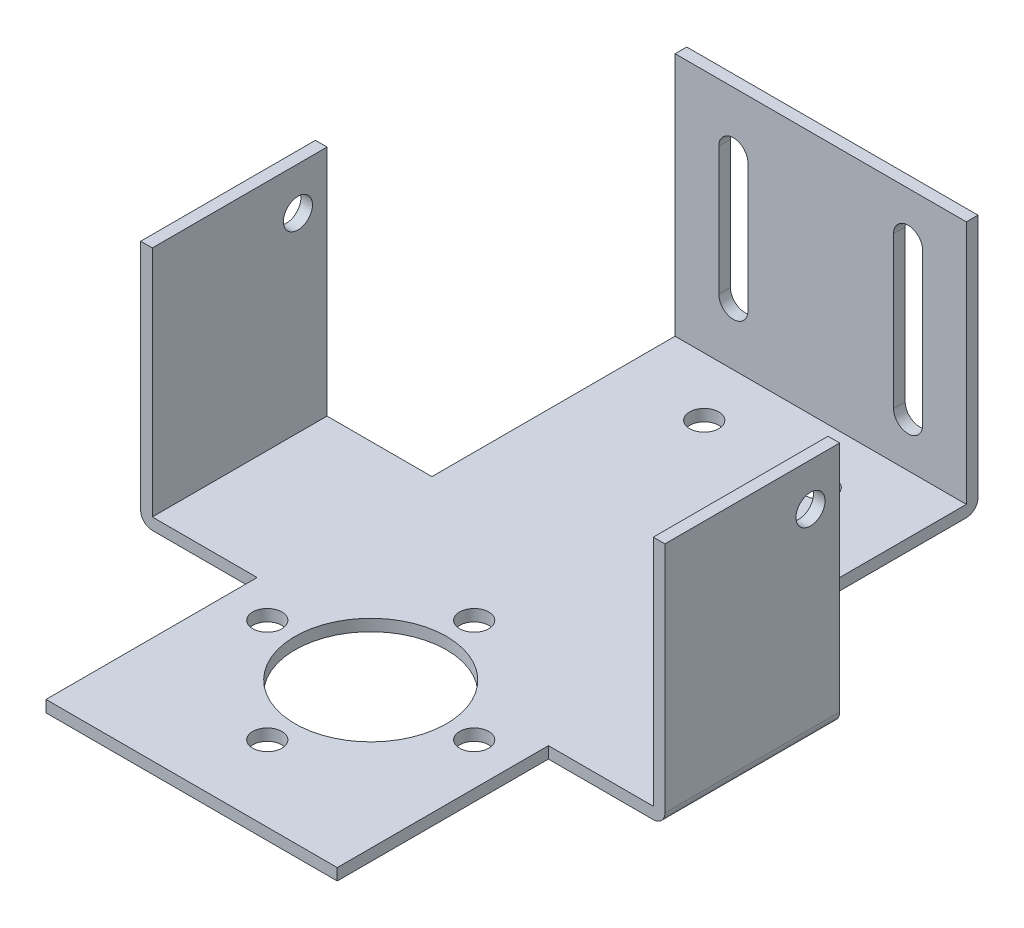
from build123d import *

# Parameters (mm, degrees)
SKETCH_1_W          = 50
SKETCH_1_H          = 42
EXTRUDE_1_DEPTH     = 2
SKETCH_2_W          = 50
SKETCH_2_H          = 110
EXTRUDE_2_DEPTH     = 2
CUT_EXTRUDE_1_REACH = 123.083
SKETCH_3_R          = 2.5
CUT_EXTRUDE_2_REACH = 123.083
SKETCH_4_R          = 13
FILLET_1_R          = 2
SKETCH_5_W          = 30
SKETCH_5_H          = 2
EXTRUDE_3_DEPTH     = 18
SKETCH_6_W          = 30
SKETCH_6_H          = 42
EXTRUDE_4_DEPTH     = 2
FILLET_2_R          = 2
CUT_EXTRUDE_3_REACH = 144.734
SKETCH_7_R          = 2.5
CUT_EXTRUDE_4_REACH = 128.732
SKETCH_8_R          = 2.5


with BuildPart() as part:
    # 草图1 → 凸台-拉伸1 (new body)
    with BuildSketch(Plane.XY):
        Rectangle(SKETCH_1_W, SKETCH_1_H)
        with BuildLine():
            Line((-17.5, 11), (-17.5, -11))
            ThreePointArc((-17.5, -11), (-15, -13.5), (-12.5, -11))
            Line((-12.5, -11), (-12.5, 11))
            ThreePointArc((-12.5, 11), (-15, 13.5), (-17.5, 11))
        make_face(mode=Mode.SUBTRACT)
        with BuildLine():
            Line((12.5, 13), (12.5, -13))
            ThreePointArc((12.5, -13), (15, -15.5), (17.5, -13))
            Line((17.5, -13), (17.5, 13))
            ThreePointArc((17.5, 13), (15, 15.5), (12.5, 13))
        make_face(mode=Mode.SUBTRACT)
    extrude(amount=EXTRUDE_1_DEPTH)

    # 草图2 → 凸台-拉伸2 (add)
    with BuildSketch(Plane.XZ.offset(21)):
        with Locations((0, 55)):
            Rectangle(SKETCH_2_W, SKETCH_2_H)
    extrude(amount=EXTRUDE_2_DEPTH)

    # 草图3 → 切除-拉伸1 (cut, up to next)
    with BuildSketch(Plane.XZ.offset(23), mode=Mode.PRIVATE) as cut_extrude_1_sk1:
        with Locations((17.76, 79.25)):
            Circle(SKETCH_3_R)
    cut_extrude_1_tool1 = extrude(cut_extrude_1_sk1.sketch, amount=-CUT_EXTRUDE_1_REACH, mode=Mode.PRIVATE) & part.part
    # 草图3 → 切除-拉伸1 (cut, up to next)
    with BuildSketch(Plane.XZ.offset(23), mode=Mode.PRIVATE) as cut_extrude_1_sk2:
        with Locations((-17.76, 79.25)):
            Circle(SKETCH_3_R)
    cut_extrude_1_tool2 = extrude(cut_extrude_1_sk2.sketch, amount=-CUT_EXTRUDE_1_REACH, mode=Mode.PRIVATE) & part.part
    # 草图3 → 切除-拉伸1 (cut, up to next)
    with BuildSketch(Plane.XZ.offset(23), mode=Mode.PRIVATE) as cut_extrude_1_sk3:
        with Locations((0, 61.49)):
            Circle(SKETCH_3_R)
    cut_extrude_1_tool3 = extrude(cut_extrude_1_sk3.sketch, amount=-CUT_EXTRUDE_1_REACH, mode=Mode.PRIVATE) & part.part
    # 草图3 → 切除-拉伸1 (cut, up to next)
    with BuildSketch(Plane.XZ.offset(23), mode=Mode.PRIVATE) as cut_extrude_1_sk4:
        with Locations((0, 97.01)):
            Circle(SKETCH_3_R)
    cut_extrude_1_tool4 = extrude(cut_extrude_1_sk4.sketch, amount=-CUT_EXTRUDE_1_REACH, mode=Mode.PRIVATE) & part.part
    add(cut_extrude_1_tool1.solids().sort_by_distance((17.76, -23, 79.25))[0], mode=Mode.SUBTRACT)
    add(cut_extrude_1_tool2.solids().sort_by_distance((-17.76, -23, 79.25))[0], mode=Mode.SUBTRACT)
    add(cut_extrude_1_tool3.solids().sort_by_distance((0, -23, 61.49))[0], mode=Mode.SUBTRACT)
    add(cut_extrude_1_tool4.solids().sort_by_distance((0, -23, 97.01))[0], mode=Mode.SUBTRACT)

    # 草图4 → 切除-拉伸2 (cut, up to next)
    with BuildSketch(Plane.XZ.offset(23), mode=Mode.PRIVATE) as cut_extrude_2_sk1:
        with Locations((0, 79.25)):
            Circle(SKETCH_4_R)
    cut_extrude_2_tool1 = extrude(cut_extrude_2_sk1.sketch, amount=-CUT_EXTRUDE_2_REACH, mode=Mode.PRIVATE) & part.part
    add(cut_extrude_2_tool1.solids().sort_by_distance((0, -23, 79.25))[0], mode=Mode.SUBTRACT)

    # 圆角1
    fillet_1_edges = [part.edges().sort_by_distance(p)[0] for p in [
        (0, -23, 0),
    ]]
    fillet(fillet_1_edges, radius=FILLET_1_R)

    # 草图5 → 凸台-拉伸3 (add)
    with BuildSketch(Plane(origin=(25, 0, 0), x_dir=(0, 0, -1), z_dir=(1, 0, 0))):
        with Locations((-58.75, -22)):
            Rectangle(SKETCH_5_W, SKETCH_5_H)
    extrude_3 = extrude(amount=EXTRUDE_3_DEPTH)

    # 草图6 → 凸台-拉伸4 (add)
    with BuildSketch(Plane(origin=(43, 0, 0), x_dir=(0, 0, -1), z_dir=(1, 0, 0))):
        with Locations((-58.75, -2)):
            Rectangle(SKETCH_6_W, SKETCH_6_H)
    extrude_4 = extrude(amount=EXTRUDE_4_DEPTH)

    # 镜向1: 凸台-拉伸3, 凸台-拉伸4 across plane
    add(extrude_3.mirror(Plane(origin=(0, 0, 0), x_dir=(0, 0, 1), z_dir=(1, 0, 0))))
    add(extrude_4.mirror(Plane(origin=(0, 0, 0), x_dir=(0, 0, 1), z_dir=(1, 0, 0))))

    # 圆角2
    fillet_2_edges = [part.edges().sort_by_distance(p)[0] for p in [
        (-45, -23, 58.75),
        (45, -23, 58.75),
    ]]
    fillet(fillet_2_edges, radius=FILLET_2_R)

    # 草图7 → 切除-拉伸3 (cut, up to next)
    with BuildSketch(Plane(origin=(-43, 0, 0), x_dir=(0, 0, -1), z_dir=(1, 0, 0)), mode=Mode.PRIVATE) as cut_extrude_3_sk1:
        with Locations((-48.75, 11.67)):
            Circle(SKETCH_7_R)
    cut_extrude_3_tool1 = extrude(cut_extrude_3_sk1.sketch, amount=-CUT_EXTRUDE_3_REACH, mode=Mode.PRIVATE) & part.part
    cut_extrude_3 = cut_extrude_3_tool1.solids().sort_by_distance((-43, 11.67, 48.75))[0]
    add(cut_extrude_3, mode=Mode.SUBTRACT)

    # 镜向2: 切除-拉伸3 across plane
    add(cut_extrude_3.mirror(Plane(origin=(0, 0, 0), x_dir=(0, 0, 1), z_dir=(1, 0, 0))), mode=Mode.SUBTRACT)

    # 草图8 → 切除-拉伸4 (cut, up to next)
    with BuildSketch(Plane.XZ.offset(23), mode=Mode.PRIVATE) as cut_extrude_4_sk1:
        with Locations((10, 12)):
            Circle(SKETCH_8_R)
    cut_extrude_4_tool1 = extrude(cut_extrude_4_sk1.sketch, amount=-CUT_EXTRUDE_4_REACH, mode=Mode.PRIVATE) & part.part
    # 草图8 → 切除-拉伸4 (cut, up to next)
    with BuildSketch(Plane.XZ.offset(23), mode=Mode.PRIVATE) as cut_extrude_4_sk2:
        with Locations((-10, 12)):
            Circle(SKETCH_8_R)
    cut_extrude_4_tool2 = extrude(cut_extrude_4_sk2.sketch, amount=-CUT_EXTRUDE_4_REACH, mode=Mode.PRIVATE) & part.part
    add(cut_extrude_4_tool1.solids().sort_by_distance((10, -23, 12))[0], mode=Mode.SUBTRACT)
    add(cut_extrude_4_tool2.solids().sort_by_distance((-10, -23, 12))[0], mode=Mode.SUBTRACT)


solid = part.part
